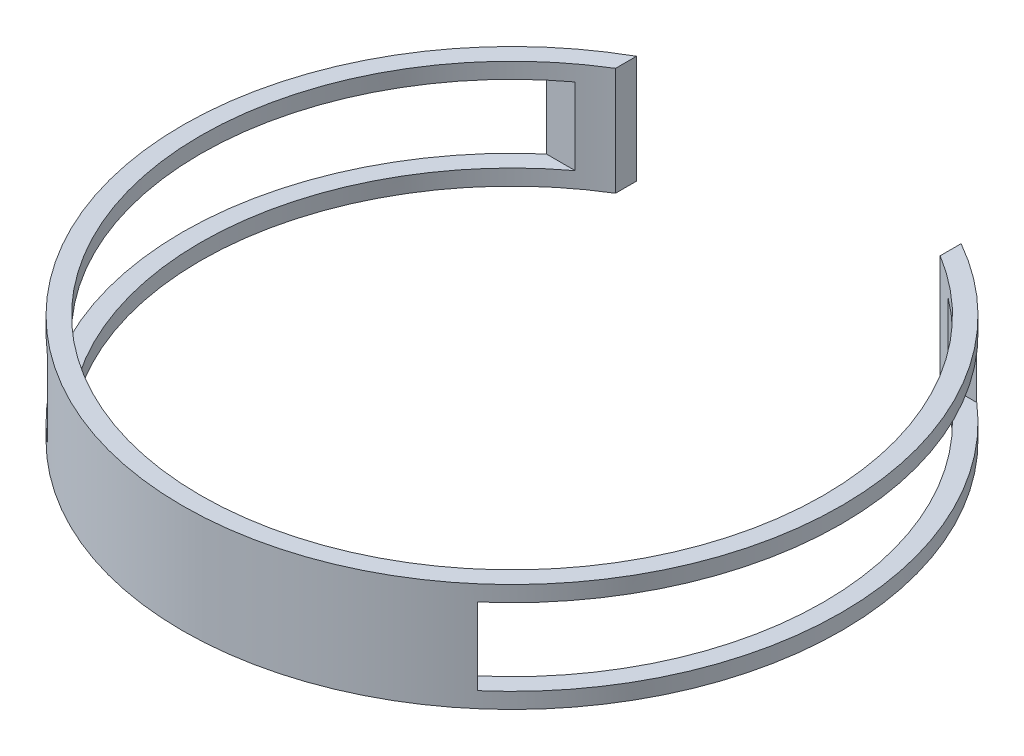
from build123d import *

# Parameters (mm, degrees)
SKETCH2_R               = 91.355
SKETCH2_R_2             = 86.355
BOSS_EXTRUDE1_DEPTH     = 15
SKETCH5_W               = 90
SKETCH5_H               = 30
CUT_EXTRUDE1_DEPTH      = 131.063338609
CUT_EXTRUDE2_DEPTH      = 131.063338609
CUT_EXTRUDE2_DEPTH_BACK = 131.063338609
SKETCH6_W               = 138.372037672
SKETCH6_H               = 21.288005796


with BuildPart() as part:
    # Sketch2 → Boss-Extrude1 (new, symmetric)
    with BuildSketch(Plane(origin=(0, 0, 0), x_dir=(1, 0, 0), z_dir=(0, 1, 0))):
        with Locations(Location((0, 0, 0), (0, 0, 270))):
            Circle(SKETCH2_R)
        with Locations(Location((0, 0, 0), (0, 0, 270))):
            Circle(SKETCH2_R_2, mode=Mode.SUBTRACT)
    extrude(amount=BOSS_EXTRUDE1_DEPTH, both=True)

    # Sketch5 → Cut-Extrude1 (cut, through all)
    with BuildSketch(Plane.XY):
        Rectangle(SKETCH5_W, SKETCH5_H)
    extrude(amount=-CUT_EXTRUDE1_DEPTH, mode=Mode.SUBTRACT)

    # Sketch6 → Cut-Extrude2 (cut, two sides: drawn at the far end of the back side and taken through both)
    with BuildSketch(Plane(origin=(0, 0, 0), x_dir=(0, 0, -1), z_dir=(1, 0, 0)).offset(-CUT_EXTRUDE2_DEPTH_BACK)):
        Rectangle(SKETCH6_W, SKETCH6_H)
    extrude(amount=CUT_EXTRUDE2_DEPTH + CUT_EXTRUDE2_DEPTH_BACK, mode=Mode.SUBTRACT)


solid = part.part
